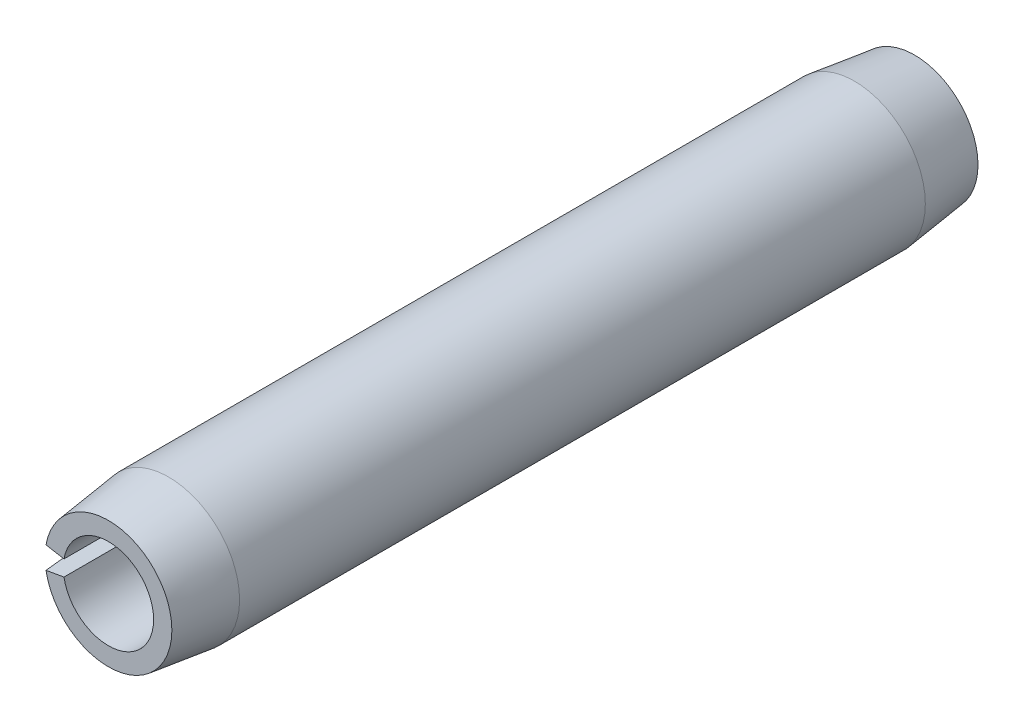
from build123d import *

# Parameters (mm, degrees)
EXTRUDE1_DEPTH = 4.7625


with BuildPart() as part:
    # Sketch1 → Extrude1 (new, symmetric)
    with BuildSketch(Plane.XY):
        with BuildLine():
            Line((-0.825465859, 0.145551903), (-0.525296455, 0.092623938))
            ThreePointArc((-0.525296455, 0.092623938), (0.5334, 0), (-0.525296455, -0.092623938))
            Line((-0.525296455, -0.092623938), (-0.825465859, -0.145551903))
            ThreePointArc((-0.825465859, -0.145551903), (0.8382, 0), (-0.825465859, 0.145551903))
        make_face()
    extrude(amount=EXTRUDE1_DEPTH, both=True)

    # Sketch2 → Cut-Revolve1 (revolve, cut)
    with BuildSketch(Plane(origin=(0, 0, 0), x_dir=(0, 0, -1), z_dir=(1, 0, 0))):
        Polygon((4.7625, 0.8382), (4.7625, 0.7493), (4.0513, 0.8382), align=None)
        Polygon((-4.0513, 0.8382), (-4.7625, 0.8382), (-4.7625, 0.7493), align=None)
    revolve(axis=Axis((0, 0, -4.7625), (0, 0, 1)), mode=Mode.SUBTRACT)


solid = part.part
